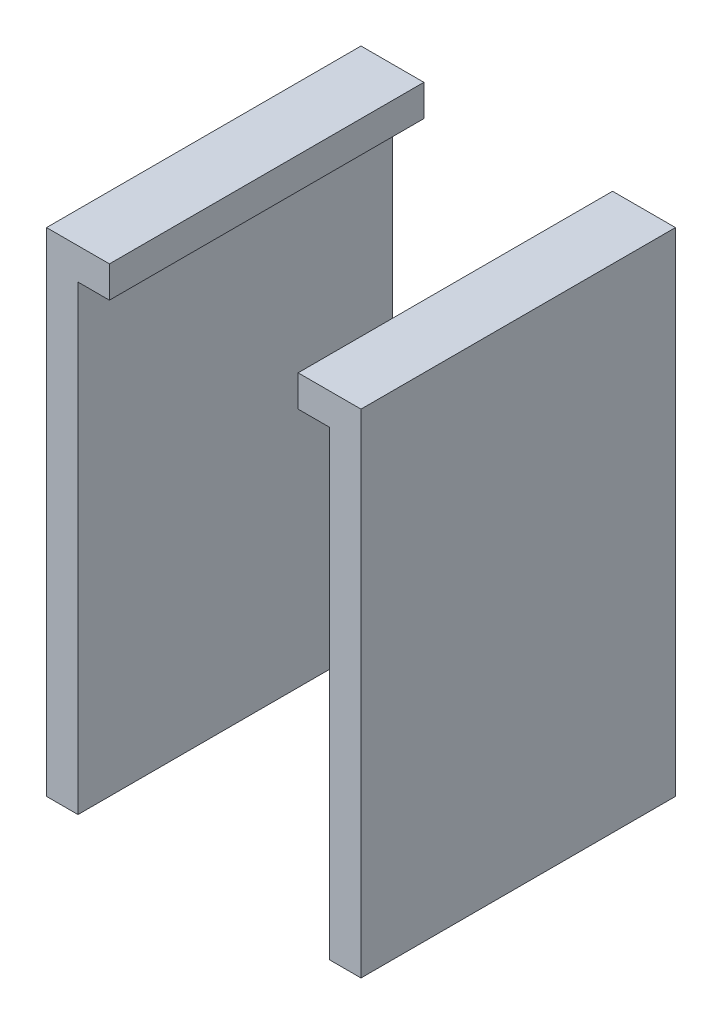
from build123d import *

# Parameters (mm, degrees)
BOSS_EXTRUDE1_DEPTH   = 150
BOSS_EXTRUDE1_2_DEPTH = 150


with BuildPart() as part:
    # Sketch1 → Boss-Extrude1 (new body)
    with BuildSketch(Plane.XY):
        Polygon((0, 0), (0, 235), (30, 235), (30, 220), (15, 220), (15, 0), align=None)
    extrude(amount=BOSS_EXTRUDE1_DEPTH)


with BuildPart() as body_2:
    # Sketch1 → Boss-Extrude1 2 (new body)
    with BuildSketch(Plane.XY):
        Polygon((135, 0), (135, 220), (120, 220), (120, 235), (150, 235), (150, 0), align=None)
    extrude(amount=BOSS_EXTRUDE1_2_DEPTH)


solid = Compound([part.part, body_2.part])
